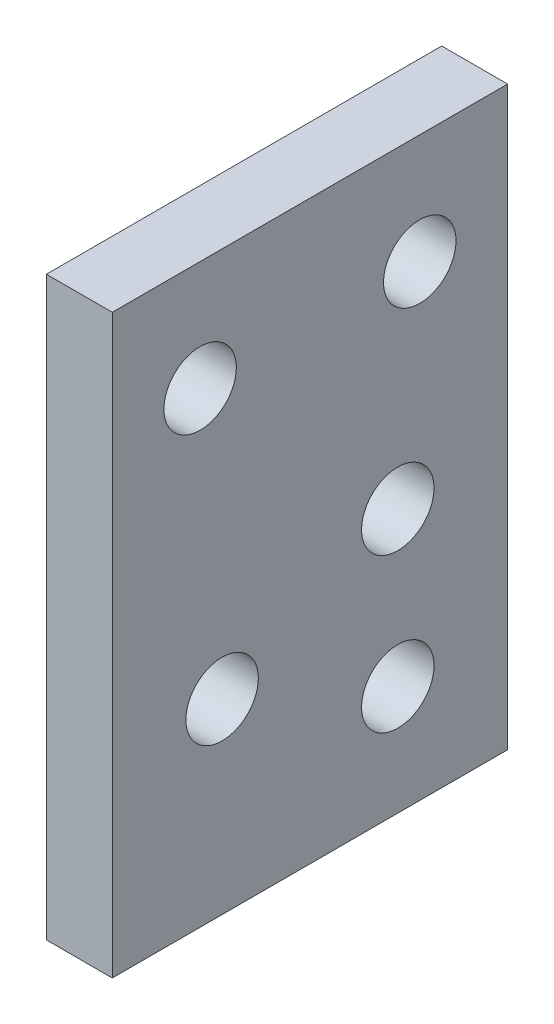
from build123d import *

# Parameters (mm, degrees)
SKETCH_1_W      = 18
SKETCH_1_H      = 26.25
SKETCH_1_R      = 1.65
EXTRUDE_1_DEPTH = 3


with BuildPart() as part:
    # 草图1 → 凸台-拉伸1 (new body)
    with BuildSketch(Plane(origin=(0, 0, 0), x_dir=(0, 0, -1), z_dir=(1, 0, 0))):
        Rectangle(SKETCH_1_W, SKETCH_1_H)
        with Locations((4, -1.125)):
            Circle(SKETCH_1_R, mode=Mode.SUBTRACT)
        with Locations((4, -8.125)):
            Circle(SKETCH_1_R, mode=Mode.SUBTRACT)
        with Locations((-4, -4.625)):
            Circle(SKETCH_1_R, mode=Mode.SUBTRACT)
        with Locations((-5, 8.125)):
            Circle(SKETCH_1_R, mode=Mode.SUBTRACT)
        with Locations((5, 8.125)):
            Circle(SKETCH_1_R, mode=Mode.SUBTRACT)
    extrude(amount=EXTRUDE_1_DEPTH)


solid = part.part
